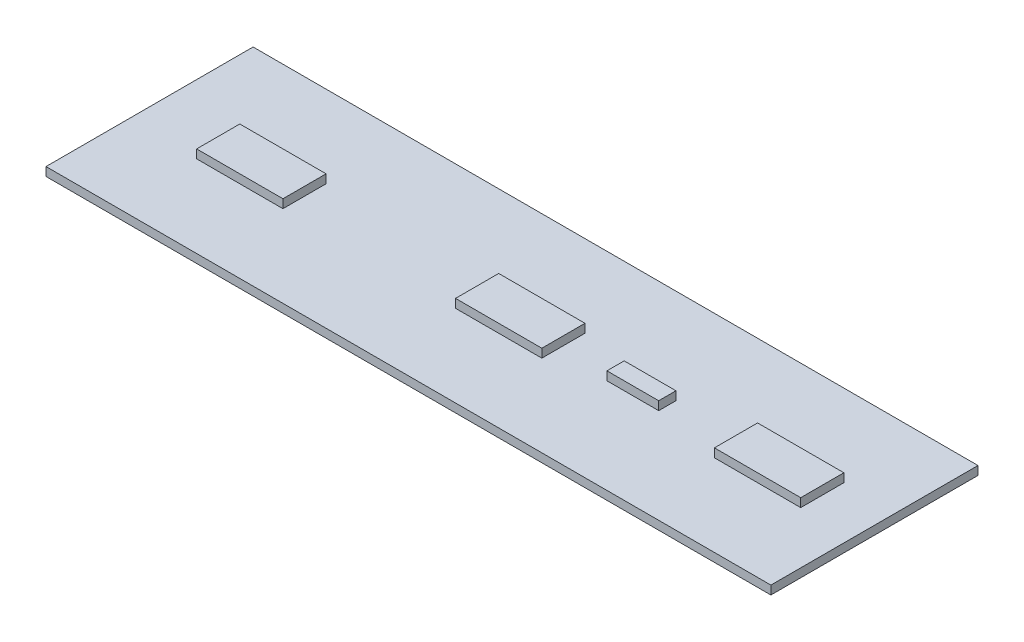
from build123d import *

# Parameters (mm, degrees)
SKETCH_1_W      = 42
SKETCH_1_H      = 12
EXTRUDE_1_DEPTH = 0.5
SKETCH_2_W      = 5
SKETCH_2_H      = 2.5
SKETCH_2_W_2    = 3
SKETCH_2_H_2    = 1
EXTRUDE_2_DEPTH = 0.5


with BuildPart() as part:
    # Эскиз1 → Бобышка-Вытянуть1 (new body)
    with BuildSketch(Plane(origin=(0, 0, 0), x_dir=(1, 0, 0), z_dir=(0, 1, 0))):
        with Locations((-3.781609195, -1.091954023)):
            Rectangle(SKETCH_1_W, SKETCH_1_H)
    extrude(amount=EXTRUDE_1_DEPTH)

    # Эскиз2 → Бобышка-Вытянуть2 (add)
    with BuildSketch(Plane(origin=(0, 0.5, 0), x_dir=(1, 0, 0), z_dir=(0, 1, 0))):
        with Locations((-3.302993855, -1.091954023)):
            Rectangle(SKETCH_2_W, SKETCH_2_H)
        with Locations((11.697006145, -1.091954023)):
            Rectangle(SKETCH_2_W, SKETCH_2_H)
        with Locations((-18.302993855, -1.091954023)):
            Rectangle(SKETCH_2_W, SKETCH_2_H)
        with Locations((3.718390805, -1.091954023)):
            Rectangle(SKETCH_2_W_2, SKETCH_2_H_2)
    extrude(amount=EXTRUDE_2_DEPTH)


solid = part.part
